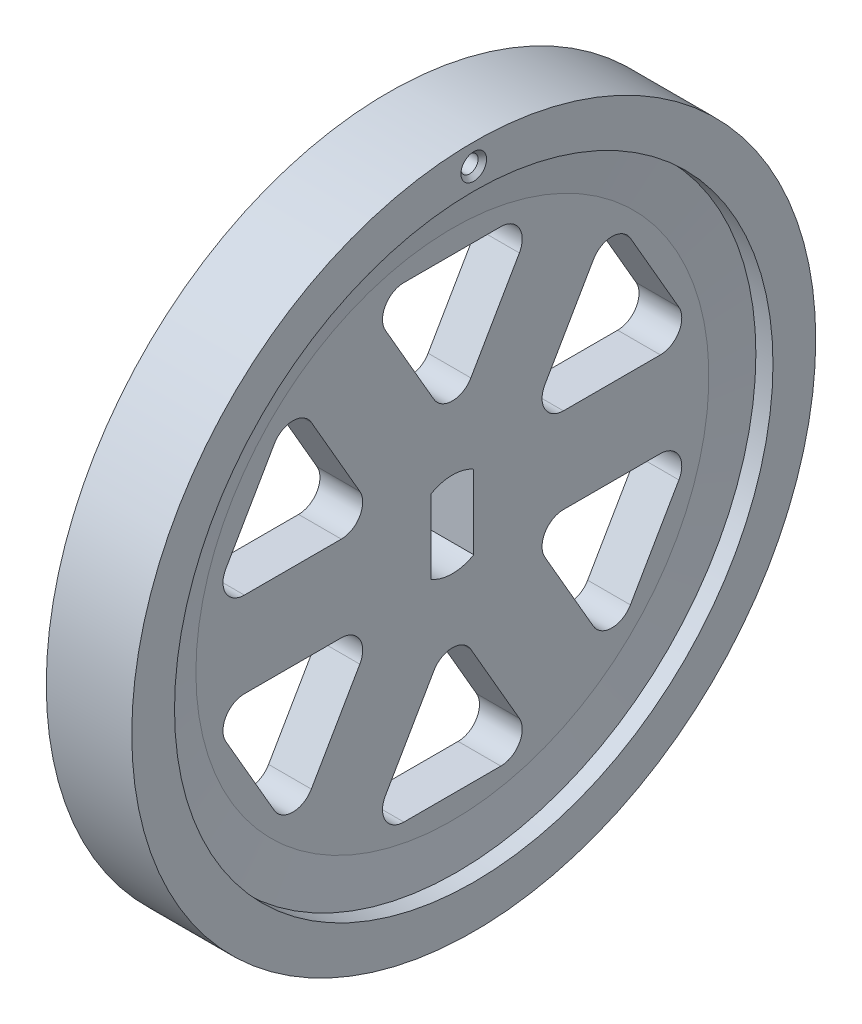
from build123d import *

# Parameters (mm, degrees)
CUT_EXTRUDE1_DEPTH                = 145.941445074
CIRPATTERN1_COUNT                 = 6
CUT_EXTRUDE2_DEPTH                = 145.941445074
F_1_4_20_TAPPED_HOLE1_D           = 5.1054
F_1_4_20_TAPPED_HOLE1_DEPTH       = 12.7
F_1_4_20_TAPPED_HOLE1_CSINK_D     = 7.62
F_1_4_20_TAPPED_HOLE1_CSINK_ANGLE = 90
F_1_4_20_TAPPED_HOLE1_TIP         = 1.533816902


with BuildPart() as part:
    # Sketch1 → Revolve1 (revolve)
    with BuildSketch(Plane.XY, mode=Mode.PRIVATE) as revolve1_sk:
        Polygon((-6.35, 0), (6.35, 0), (6.35, 76.2), (7.62, 88.9), (12.7, 88.9), (12.7, 101.6), (-12.7, 101.6), (-12.7, 88.9), (-7.62, 88.9), (-6.35, 76.2), align=None)
    revolve(revolve1_sk.sketch.rotate(Axis((-21.230059302, 0, 0), (1, 0, 0)), 90), axis=Axis((-21.230059302, 0, 0), (1, 0, 0)))

    # Sketch2 → Cut-Extrude1 (cut, through all)
    with BuildSketch(Plane(origin=(6.35, 0, 0), x_dir=(0, 0, -1), z_dir=(1, 0, 0))):
        with BuildLine():
            Line((5.499261314, 34.925), (19.900738686, 59.869090512))
            ThreePointArc((19.900738686, 59.869090512), (19.900738686, 66.219090512), (14.401477372, 69.394090512))
            Line((14.401477372, 69.394090512), (-14.401477372, 69.394090512))
            ThreePointArc((-14.401477372, 69.394090512), (-19.900738686, 66.219090512), (-19.900738686, 59.869090512))
            Line((-19.900738686, 59.869090512), (-5.499261314, 34.925))
            ThreePointArc((-5.499261314, 34.925), (0, 31.75), (5.499261314, 34.925))
        make_face()
    cut_extrude1 = extrude(amount=-CUT_EXTRUDE1_DEPTH, mode=Mode.SUBTRACT)

    # CirPattern1: Cut-Extrude1 ×6 about axis
    cirpattern1_axis = Axis((0, 0, 0), (1, 0, 0))
    for i in range(1, CIRPATTERN1_COUNT):
        add(cut_extrude1.rotate(cirpattern1_axis, i * 360 / CIRPATTERN1_COUNT), mode=Mode.SUBTRACT)

    # Sketch3 → Cut-Extrude2 (cut, through all)
    with BuildSketch(Plane(origin=(6.35, 0, 0), x_dir=(0, 0, -1), z_dir=(1, 0, 0))):
        with BuildLine():
            Line((-6.35, 10.998522628), (-6.35, -10.998522628))
            ThreePointArc((-6.35, -10.998522628), (0, -12.7), (6.35, -10.998522628))
            Line((6.35, -10.998522628), (6.35, 10.998522628))
            ThreePointArc((6.35, 10.998522628), (0, 12.7), (-6.35, 10.998522628))
        make_face()
    extrude(amount=-CUT_EXTRUDE2_DEPTH, mode=Mode.SUBTRACT)

    # 1/4-20 Tapped Hole1
    with Locations(Plane(origin=(12.7, 0, 0), x_dir=(0, 0, -1), z_dir=(1, 0, 0))):
        with Locations((0, 95.25)):
            CounterSinkHole(F_1_4_20_TAPPED_HOLE1_D / 2, F_1_4_20_TAPPED_HOLE1_CSINK_D / 2, depth=F_1_4_20_TAPPED_HOLE1_DEPTH, counter_sink_angle=F_1_4_20_TAPPED_HOLE1_CSINK_ANGLE)
            with Locations((0, 0, -(F_1_4_20_TAPPED_HOLE1_DEPTH + F_1_4_20_TAPPED_HOLE1_TIP / 2))):  # 118° drill point
                Cone(0, F_1_4_20_TAPPED_HOLE1_D / 2, F_1_4_20_TAPPED_HOLE1_TIP, mode=Mode.SUBTRACT)


solid = part.part
